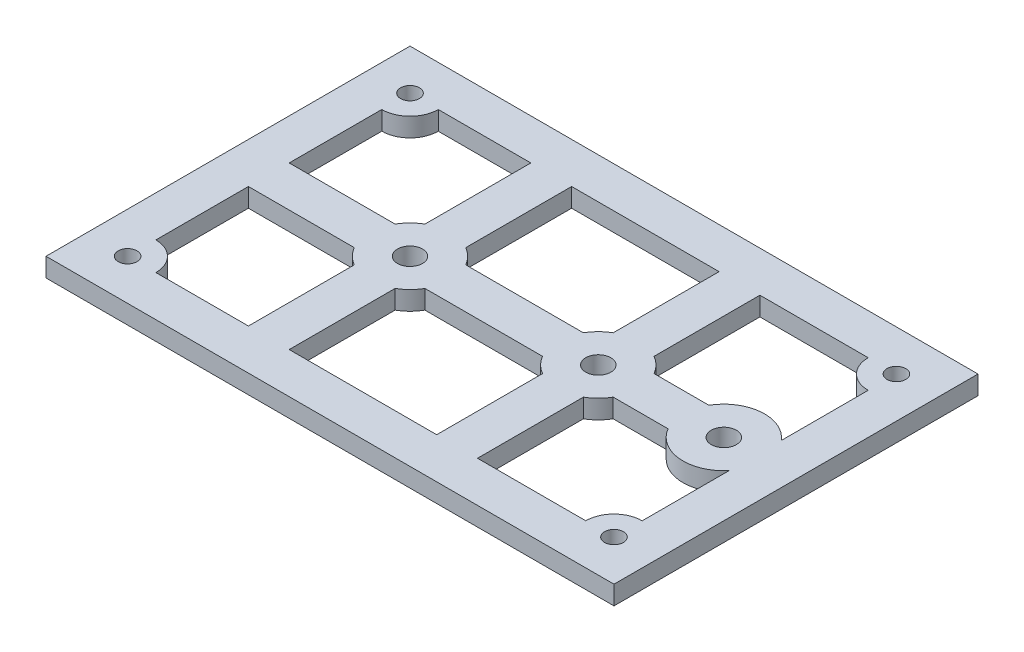
from build123d import *

# Parameters (mm, degrees)
SKETCH1_R           = 5
SKETCH1_R_2         = 22.5
SKETCH1_R_3         = 15
SKETCH1_R_4         = 7.5
BOSS_EXTRUDE1_DEPTH = 3
SKETCH3_W           = 90.5
SKETCH3_H           = 58
SKETCH3_W_2         = 77.5
SKETCH3_H_2         = 45
BOSS_EXTRUDE2_DEPTH = 3
SKETCH2_R           = 1.5
SKETCH2_R_2         = 2
CUT_EXTRUDE1_DEPTH  = 3


with BuildPart() as part:
    # Sketch1 → Boss-Extrude1 (new body)
    # profile 1 of 12: a face of its own
    with BuildSketch(Plane(origin=(0, 0, 0), x_dir=(1, 0, 0), z_dir=(0, 1, 0))):
        with BuildLine():
            Line((25, 22.5), (-30, 22.5))
            ThreePointArc((-30, 22.5), (-18.572778714, 19.382172574), (-10.3125, 10.892765661))
            ThreePointArc((-10.3125, 10.892765661), (5.929270613, 13.778379803), (15, 0))
            ThreePointArc((15, 0), (20, 5), (25, 0))
            Line((25, 0), (25, 22.5))
        make_face()
    # profile 2 of 12: a face of its own
    with BuildSketch(Plane(origin=(0, 0, 0), x_dir=(1, 0, 0), z_dir=(0, 1, 0))):
        with BuildLine():
            ThreePointArc((-10.3125, -10.892765661), (-18.572778714, -19.382172574), (-30, -22.5))
            Line((-30, -22.5), (25, -22.5))
            Line((25, -22.5), (25, 0))
            ThreePointArc((25, 0), (20, -5), (15, 0))
            ThreePointArc((15, 0), (5.929270613, -13.778379803), (-10.3125, -10.892765661))
        make_face()
    # profile 3 of 12: a face of its own
    with BuildSketch(Plane(origin=(0, 0, 0), x_dir=(1, 0, 0), z_dir=(0, 1, 0))):
        with BuildLine():
            Line((-30, 22.5), (-52.5, 22.5))
            Line((-52.5, 22.5), (-52.5, 6.7e-08))
            ThreePointArc((-52.5, 6.7e-08), (-45.909902553, 15.9099026), (-30, 22.5))
        make_face()
    # profile 4 of 12: a face of its own
    with BuildSketch(Plane(origin=(0, 0, 0), x_dir=(1, 0, 0), z_dir=(0, 1, 0))):
        with BuildLine():
            ThreePointArc((-30, -22.5), (-45.9099026, -15.909902553), (-52.5, 6.7e-08))
            Line((-52.5, 6.7e-08), (-52.5, -22.5))
            Line((-52.5, -22.5), (-30, -22.5))
        make_face()
    # profile 5 of 12: a face of its own
    with BuildSketch(Plane(origin=(0, 0, 0), x_dir=(1, 0, 0), z_dir=(0, 1, 0))):
        with Locations((20, 0)):
            Circle(SKETCH1_R)
    # profile 6 of 12: a face of its own
    with BuildSketch(Plane(origin=(0, 0, 0), x_dir=(1, 0, 0), z_dir=(0, 1, 0))):
        with Locations((-30, 0)):
            Circle(SKETCH1_R_2)
    # profile 7 of 12: a face of its own
    with BuildSketch(Plane(origin=(0, 0, 0), x_dir=(1, 0, 0), z_dir=(0, 1, 0))):
        Circle(SKETCH1_R_3)
        Circle(SKETCH1_R_4, mode=Mode.SUBTRACT)
    # profile 8 of 12: a face of its own
    with BuildSketch(Plane(origin=(0, 0, 0), x_dir=(1, 0, 0), z_dir=(0, 1, 0))):
        Circle(SKETCH1_R_4)
    # profile 9 of 12: a face of its own
    with BuildSketch(Plane(origin=(0, 0, 0), x_dir=(1, 0, 0), z_dir=(0, 1, 0))):
        Circle(SKETCH1_R_3)
    # profile 10 of 12: a face of its own
    with BuildSketch(Plane(origin=(0, 0, 0), x_dir=(1, 0, 0), z_dir=(0, 1, 0))):
        with Locations((-30, 0)):
            Circle(SKETCH1_R_2)
    # profile 11 of 12: a face of its own
    with BuildSketch(Plane(origin=(0, 0, 0), x_dir=(1, 0, 0), z_dir=(0, 1, 0))):
        with Locations((-30, 0)):
            Circle(SKETCH1_R_2)
    # profile 12 of 12: a face of its own
    with BuildSketch(Plane(origin=(0, 0, 0), x_dir=(1, 0, 0), z_dir=(0, 1, 0))):
        Circle(SKETCH1_R_3)
    extrude(amount=BOSS_EXTRUDE1_DEPTH)

    # Sketch3 → Boss-Extrude2 (add)
    with BuildSketch(Plane(origin=(0, 3, 0), x_dir=(1, 0, 0), z_dir=(0, 1, 0))):
        with Locations((-13.75, 0)):
            Rectangle(SKETCH3_W, SKETCH3_H)
        with Locations((-13.75, 0)):
            Rectangle(SKETCH3_W_2, SKETCH3_H_2, mode=Mode.SUBTRACT)
    extrude(amount=-BOSS_EXTRUDE2_DEPTH)

    # Sketch2 → Cut-Extrude1 (cut)
    with BuildSketch(Plane(origin=(0, 3, 0), x_dir=(1, 0, 0), z_dir=(0, 1, 0))):
        with BuildLine():
            Line((-26.75, 22.5), (-26.75, 5.629165125))
            ThreePointArc((-26.75, 5.629165125), (-25.403805922, 4.596194078), (-24.370834875, 3.25))
            Line((-24.370834875, 3.25), (-5.629165125, 3.25))
            ThreePointArc((-5.629165125, 3.25), (-4.596194078, 4.596194078), (-3.25, 5.629165125))
            Line((-3.25, 5.629165125), (-3.25, 22.5))
            Line((-3.25, 22.5), (-26.75, 22.5))
        make_face()
        with BuildLine():
            Line((-5.629165125, -3.25), (-24.370834875, -3.25))
            ThreePointArc((-24.370834875, -3.25), (-25.403805922, -4.596194078), (-26.75, -5.629165125))
            Line((-26.75, -5.629165125), (-26.75, -22.5))
            Line((-26.75, -22.5), (-3.25, -22.5))
            Line((-3.25, -22.5), (-3.25, -5.629165125))
            ThreePointArc((-3.25, -5.629165125), (-4.596194078, -4.596194078), (-5.629165125, -3.25))
        make_face()
        with BuildLine():
            ThreePointArc((-48, -22.5), (-49.318019485, -19.318019485), (-52.5, -18))
            Line((-52.5, -18), (-52.5, -3.25))
            Line((-52.5, -3.25), (-35.629165125, -3.25))
            ThreePointArc((-35.629165125, -3.25), (-34.596194078, -4.596194078), (-33.25, -5.629165125))
            Line((-33.25, -5.629165125), (-33.25, -22.5))
            Line((-33.25, -22.5), (-48, -22.5))
        make_face()
        with BuildLine():
            ThreePointArc((25, 4.153311931), (19.449586247, 6.47665382), (14.370834875, 3.25))
            Line((14.370834875, 3.25), (5.629165125, 3.25))
            ThreePointArc((5.629165125, 3.25), (4.596194078, 4.596194078), (3.25, 5.629165125))
            Line((3.25, 5.629165125), (3.25, 22.5))
            Line((3.25, 22.5), (20.5, 22.5))
            ThreePointArc((20.5, 22.5), (21.818019485, 19.318019485), (25, 18))
            Line((25, 18), (25, 4.153311931))
        make_face()
        with BuildLine():
            ThreePointArc((14.370834875, -3.25), (19.449586247, -6.47665382), (25, -4.153311931))
            Line((25, -4.153311931), (25, -18))
            ThreePointArc((25, -18), (21.818019485, -19.318019485), (20.5, -22.5))
            Line((20.5, -22.5), (3.25, -22.5))
            Line((3.25, -22.5), (3.25, -5.629165125))
            ThreePointArc((3.25, -5.629165125), (4.596194078, -4.596194078), (5.629165125, -3.25))
            Line((5.629165125, -3.25), (14.370834875, -3.25))
        make_face()
        with BuildLine():
            Line((-52.5, 3.25), (-52.5, 18))
            ThreePointArc((-52.5, 18), (-49.318019485, 19.318019485), (-48, 22.5))
            Line((-48, 22.5), (-33.25, 22.5))
            Line((-33.25, 22.5), (-33.25, 5.629165125))
            ThreePointArc((-33.25, 5.629165125), (-34.596194078, 4.596194078), (-35.629165125, 3.25))
            Line((-35.629165125, 3.25), (-52.5, 3.25))
        make_face()
        with Locations(Location((-52.5, 22.5, 0), (0, 0, 270))):
            Circle(SKETCH2_R)
        with Locations(Location((-30, 0, 0), (0, 0, 90))):
            Circle(SKETCH2_R_2)
        with Locations(Location((0, 0, 0), (0, 0, 270))):
            Circle(SKETCH2_R_2)
        with Locations(Location((25, 22.5, 0), (0, 0, 90))):
            Circle(SKETCH2_R)
        with Locations(Location((20, 0, 0), (0, 0, 270))):
            Circle(SKETCH2_R_2)
        with Locations(Location((25, -22.5, 0), (0, 0, 270))):
            Circle(SKETCH2_R)
        with Locations(Location((-52.5, -22.5, 0), (0, 0, 90))):
            Circle(SKETCH2_R)
    extrude(amount=-CUT_EXTRUDE1_DEPTH, mode=Mode.SUBTRACT)


solid = part.part
